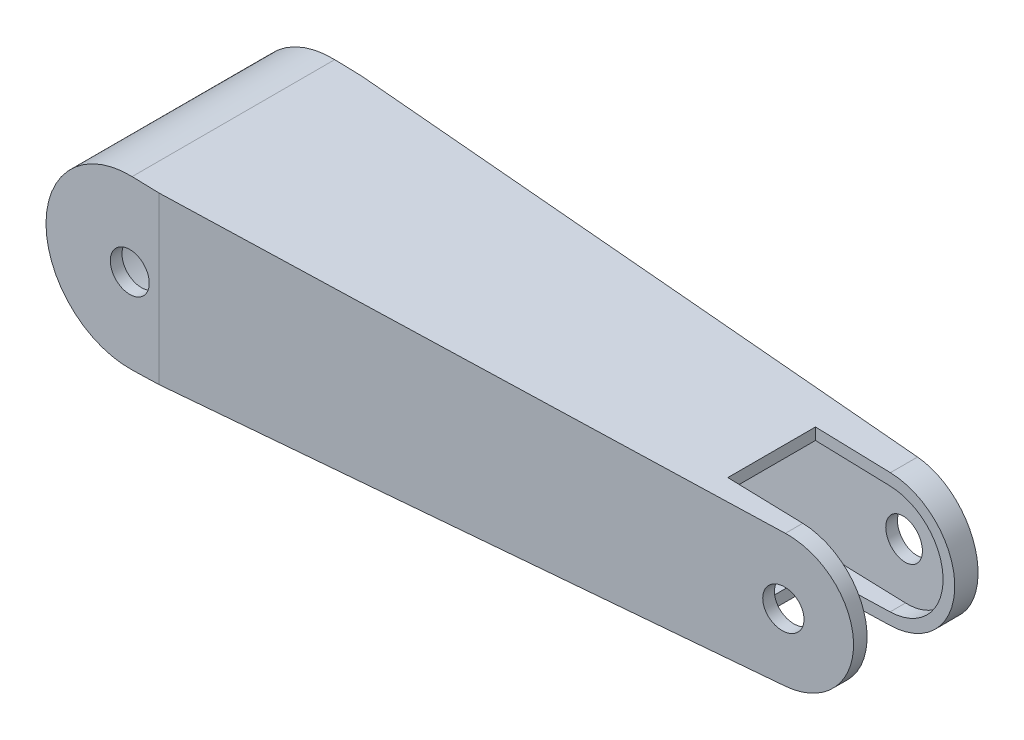
from build123d import *

# Parameters (mm, degrees)
EXTRUSION1_DEPTH             = 200
ENL_V_MAT_EXTRU_1_DEPTH      = 319.955094772
ENL_V_MAT_EXTRU_1_DEPTH_BACK = 319.955094772
ESQUISSE4_OUTSIDE_W          = 486.616
ESQUISSE4_OUTSIDE_H          = 292.116
COQUE5_T                     = 6
ENL_V_MAT_EXTRU_2_DEPTH      = 292.26680635
ENL_V_MAT_EXTRU_2_DEPTH_BACK = 292.26680635
ESQUISSE5_W                  = 100
ESQUISSE5_H                  = 45
ESQUISSE6_R                  = 10
ENL_V_MAT_EXTRU_3_DEPTH      = 270.348013695
ESQUISSE7_R                  = 10
ENL_V_MAT_EXTRU_4_DEPTH      = 270.348013695


with BuildPart() as part:
    # Esquisse2 → Extrusion1 (new body)
    with BuildSketch(Plane.XY):
        with BuildLine():
            Line((-105.570349674, 42.982720814), (211.674532216, 33.986337388))
            ThreePointArc((211.674532216, 33.986337388), (244.710752688, 0), (211.674532216, -33.986337388))
            Line((211.674532216, -33.986337388), (-105.570349674, -42.982720814))
            ThreePointArc((-105.570349674, -42.982720814), (-149.789247312, 0), (-105.570349674, 42.982720814))
        make_face()
    extrude(amount=EXTRUSION1_DEPTH)

    # Esquisse4 outside → Enlèv. mat.-Extru.1 (cut, two sides: drawn at the far end of the back side and taken through both)
    with BuildSketch(Plane(origin=(0, 0, 0), x_dir=(1, 0, 0), z_dir=(0, 1, 0)).offset(-ENL_V_MAT_EXTRU_1_DEPTH_BACK)):
        with Locations((47.461, -100)):
            Rectangle(ESQUISSE4_OUTSIDE_W, ESQUISSE4_OUTSIDE_H)
        Polygon((-158.789247312, -152), (-158.789247312, -48), (-91.789247312, -48), (311.210752688, -72), (311.210752688, -128), (-91.789247312, -152), align=None, mode=Mode.SUBTRACT)
    extrude(amount=ENL_V_MAT_EXTRU_1_DEPTH + ENL_V_MAT_EXTRU_1_DEPTH_BACK, mode=Mode.SUBTRACT)

    # Coque5 (no face opened: a closed hollow body)
    add(offset(amount=-COQUE5_T, mode=Mode.PRIVATE), mode=Mode.SUBTRACT)

    # Esquisse5 → Enlèv. mat.-Extru.2 (cut, two sides: drawn at the far end of the back side and taken through both)
    with BuildSketch(Plane(origin=(0, 0, 0), x_dir=(1, 0, 0), z_dir=(0, 1, 0)).offset(-ENL_V_MAT_EXTRU_2_DEPTH_BACK)):
        with Locations((223.210752688, -102.5)):
            Rectangle(ESQUISSE5_W, ESQUISSE5_H)
    extrude(amount=ENL_V_MAT_EXTRU_2_DEPTH + ENL_V_MAT_EXTRU_2_DEPTH_BACK, mode=Mode.SUBTRACT)

    # Esquisse6 → Enlèv. mat.-Extru.3 (cut, through all)
    with BuildSketch(Plane.XY.offset(152)):
        with Locations((210.710752688, 0)):
            Circle(ESQUISSE6_R)
    extrude(amount=-ENL_V_MAT_EXTRU_3_DEPTH, mode=Mode.SUBTRACT)

    # Esquisse7 → Enlèv. mat.-Extru.4 (cut, through all)
    with BuildSketch(Plane.XY.offset(152)):
        with Locations((-106.789247312, 0)):
            Circle(ESQUISSE7_R)
    extrude(amount=-ENL_V_MAT_EXTRU_4_DEPTH, mode=Mode.SUBTRACT)


solid = part.part
